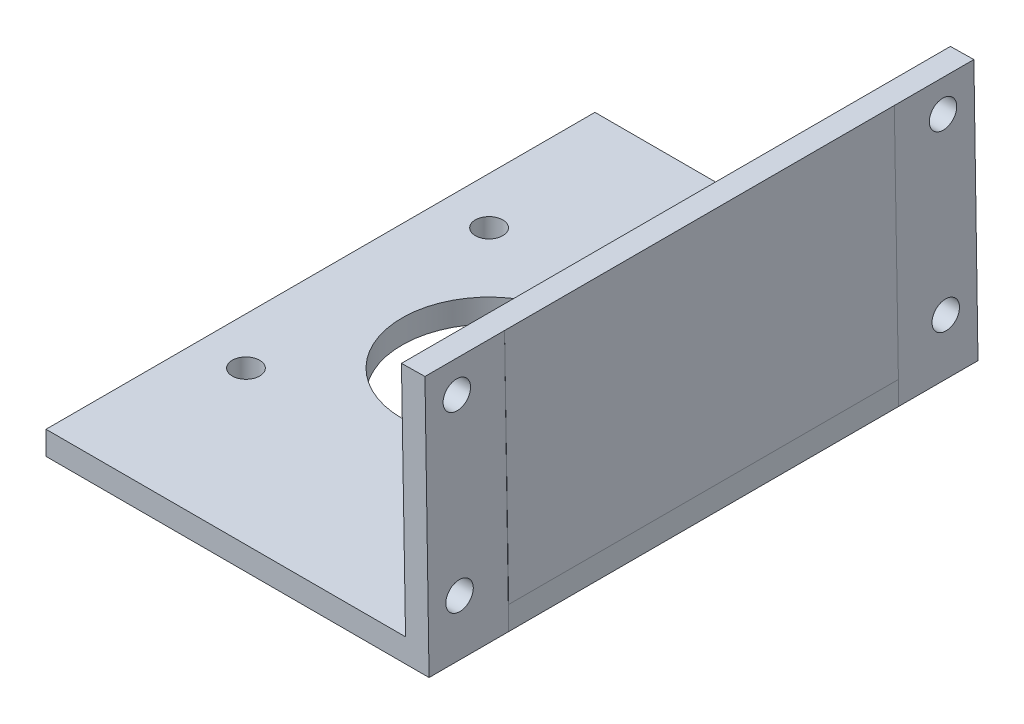
from build123d import *

# Parameters (mm, degrees)
ESBO_O1_R                = 1.75
RESSALTO_EXTRUS_O1_DEPTH = 3
CORTE_EXTRUS_O1_DEPTH    = 70.752508915
ESBO_O6_W                = 3
ESBO_O6_H                = 49.7
RESSALTO_EXTRUS_O2_DEPTH = 30
RESSALTO_EXTRUS_O5_DEPTH = 10.15
RESSALTO_EXTRUS_O6_DEPTH = 10.15
ESBO_O13_R               = 1.75
CORTE_EXTRUS_O2_DEPTH    = 84.696604677
ESBO_O14_R               = 11.1
CORTE_EXTRUS_O3_DEPTH    = 83.873825012


with BuildPart() as part:
    # Esboço1 → Ressalto-extrusão1 (new body)
    with BuildSketch(Plane(origin=(0, 0, 0), x_dir=(1, 0, 0), z_dir=(0, 1, 0))):
        Polygon((0, 0), (0, 49.7), (42, 49.7), (44.85, 49.7), (45.85, 49.7), (48.85, 49.7), (48.85, 0), (44.85, 0), (42, 0), align=None)
        with Locations(Location((6, 9.35, 0), (0, 0, 270))):
            Circle(ESBO_O1_R, mode=Mode.SUBTRACT)
        with Locations(Location((37, 40.35, 0), (0, 0, 270))):
            Circle(ESBO_O1_R, mode=Mode.SUBTRACT)
        with Locations(Location((37, 9.35, 0), (0, 0, 270))):
            Circle(ESBO_O1_R, mode=Mode.SUBTRACT)
        with Locations(Location((6, 40.35, 0), (0, 0, 270))):
            Circle(ESBO_O1_R, mode=Mode.SUBTRACT)
    extrude(amount=RESSALTO_EXTRUS_O1_DEPTH)

    # Esboço4 → Corte-extrusão1 (cut, through all)
    with BuildSketch(Plane.XY):
        Polygon((48.85, 3), (45.850456915, 2.947642781), (45.824605163, 4.428688653), (48.712091154, 4.253252959), (49.11238384, 3.101191082), align=None)
    extrude(amount=-CORTE_EXTRUS_O1_DEPTH, mode=Mode.SUBTRACT)

    # Esboço6 → Ressalto-extrusão2 (add)
    with BuildSketch(Plane(origin=(-0.037470195, 2.146666034, 0), x_dir=(0.9998476951563913, 0.01745240643728361, 0), z_dir=(-0.01745240643728361, 0.9998476951563913, 0))):
        with Locations((47.394917128, 24.85)):
            Rectangle(ESBO_O6_W, ESBO_O6_H)
    extrude(amount=RESSALTO_EXTRUS_O2_DEPTH)

    # Esboço9 → Ressalto-extrusão5 (add)
    with BuildSketch(Plane.XY):
        Polygon((48.326427807, 32.995430855), (48.85, 0), (0, 0), (0, 3), (45.849543016, 3), (45.326884721, 32.943073635), align=None)
    extrude(amount=RESSALTO_EXTRUS_O5_DEPTH)

    # Esboço12 → Ressalto-extrusão6 (add)
    with BuildSketch(Plane(origin=(0, 0, -49.7), x_dir=(-1, 0, 0), z_dir=(0, 0, -1))):
        Polygon((0, 0), (-48.85, 0), (-48.326427807, 32.995430855), (-45.326884721, 32.943073635), (-45.849543016, 3), (0, 3), align=None)
    extrude(amount=RESSALTO_EXTRUS_O6_DEPTH)

    # Esboço13 → Corte-extrusão2 (cut, through all)
    with BuildSketch(Plane(origin=(48.887470195, 0.853333966, 0), x_dir=(0, 0, -1), z_dir=(0.9998476951563913, 0.01745240643728361, 0))):
        with Locations(Location((-6.15, 28.146993031, 0), (0, 0, 90))):
            Circle(ESBO_O13_R)
        with Locations(Location((-6.15, 6.146993031, 0), (0, 0, 90))):
            Circle(ESBO_O13_R)
        with Locations(Location((55.85, 28.146993031, 0), (0, 0, 90))):
            Circle(ESBO_O13_R)
        with Locations(Location((55.85, 6.146993031, 0), (0, 0, 90))):
            Circle(ESBO_O13_R)
    extrude(amount=-CORTE_EXTRUS_O2_DEPTH, mode=Mode.SUBTRACT)

    # Esboço14 → Corte-extrusão3 (cut, through all)
    with BuildSketch(Plane(origin=(0, 3, 0), x_dir=(1, 0, 0), z_dir=(0, 1, 0))):
        with Locations(Location((21.5, 24.85, 0), (0, 0, 270))):
            Circle(ESBO_O14_R)
    extrude(amount=-CORTE_EXTRUS_O3_DEPTH, mode=Mode.SUBTRACT)


solid = part.part
